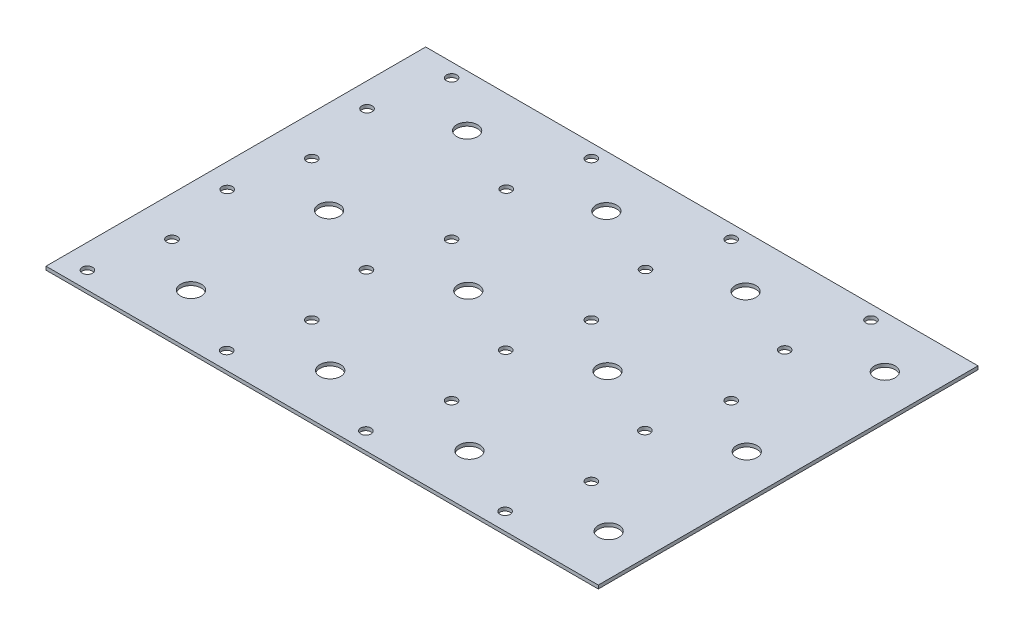
from build123d import *

# Parameters (mm, degrees)
SKETCH1_W           = 160
SKETCH1_H           = 110
BOSS_EXTRUDE1_DEPTH = 1
SKETCH2_R           = 3
SKETCH2_R_2         = 1.5
CUT_EXTRUDE1_DEPTH  = 1


with BuildPart() as part:
    # Sketch1 → Boss-Extrude1 (new body)
    with BuildSketch(Plane(origin=(0, 0, 0), x_dir=(1, 0, 0), z_dir=(0, 1, 0))):
        Rectangle(SKETCH1_W, SKETCH1_H)
    extrude(amount=BOSS_EXTRUDE1_DEPTH)

    # Sketch2 → Cut-Extrude1 (cut)
    with BuildSketch(Plane(origin=(0, 1, 0), x_dir=(1, 0, 0), z_dir=(0, 1, 0))):
        with Locations(Location((-53, 40, 0), (0, 0, 270))):
            Circle(SKETCH2_R)
        with Locations(Location((-12.666666667, 40, 0), (0, 0, 270))):
            Circle(SKETCH2_R)
        with Locations(Location((27.666666667, 40, 0), (0, 0, 270))):
            Circle(SKETCH2_R)
        with Locations(Location((68, 40, 0), (0, 0, 270))):
            Circle(SKETCH2_R)
        with Locations(Location((-12.666666667, 0, 0), (0, 0, 270))):
            Circle(SKETCH2_R)
        with Locations(Location((27.666666667, 0, 0), (0, 0, 270))):
            Circle(SKETCH2_R)
        with Locations(Location((68, 0, 0), (0, 0, 270))):
            Circle(SKETCH2_R)
        with Locations(Location((-12.666666667, -40, 0), (0, 0, 270))):
            Circle(SKETCH2_R)
        with Locations(Location((27.666666667, -40, 0), (0, 0, 270))):
            Circle(SKETCH2_R)
        with Locations(Location((68, -40, 0), (0, 0, 270))):
            Circle(SKETCH2_R)
        with Locations(Location((-53, 0, 0), (0, 0, 270))):
            Circle(SKETCH2_R)
        with Locations(Location((-53, -40, 0), (0, 0, 270))):
            Circle(SKETCH2_R)
        with Locations(Location((-68.5, 51, 0), (0, 0, 270))):
            Circle(SKETCH2_R_2)
        with Locations(Location((-28, 51, 0), (0, 0, 270))):
            Circle(SKETCH2_R_2)
        with Locations(Location((12.5, 51, 0), (0, 0, 270))):
            Circle(SKETCH2_R_2)
        with Locations(Location((53, 51, 0), (0, 0, 270))):
            Circle(SKETCH2_R_2)
        with Locations(Location((-28, 10.5, 0), (0, 0, 270))):
            Circle(SKETCH2_R_2)
        with Locations(Location((12.5, 10.5, 0), (0, 0, 270))):
            Circle(SKETCH2_R_2)
        with Locations(Location((53, 10.5, 0), (0, 0, 270))):
            Circle(SKETCH2_R_2)
        with Locations(Location((-28, -30, 0), (0, 0, 270))):
            Circle(SKETCH2_R_2)
        with Locations(Location((12.5, -30, 0), (0, 0, 270))):
            Circle(SKETCH2_R_2)
        with Locations(Location((53, -30, 0), (0, 0, 270))):
            Circle(SKETCH2_R_2)
        with Locations(Location((-68.5, 10.5, 0), (0, 0, 270))):
            Circle(SKETCH2_R_2)
        with Locations(Location((-68.5, -30, 0), (0, 0, 270))):
            Circle(SKETCH2_R_2)
        with Locations(Location((-73, 31, 0), (0, 0, 270))):
            Circle(SKETCH2_R_2)
        with Locations(Location((-32.666666667, 31, 0), (0, 0, 270))):
            Circle(SKETCH2_R_2)
        with Locations(Location((7.666666667, 31, 0), (0, 0, 270))):
            Circle(SKETCH2_R_2)
        with Locations(Location((48, 31, 0), (0, 0, 270))):
            Circle(SKETCH2_R_2)
        with Locations(Location((-32.666666667, -9.5, 0), (0, 0, 270))):
            Circle(SKETCH2_R_2)
        with Locations(Location((7.666666667, -9.5, 0), (0, 0, 270))):
            Circle(SKETCH2_R_2)
        with Locations(Location((48, -9.5, 0), (0, 0, 270))):
            Circle(SKETCH2_R_2)
        with Locations(Location((-32.666666667, -50, 0), (0, 0, 270))):
            Circle(SKETCH2_R_2)
        with Locations(Location((7.666666667, -50, 0), (0, 0, 270))):
            Circle(SKETCH2_R_2)
        with Locations(Location((48, -50, 0), (0, 0, 270))):
            Circle(SKETCH2_R_2)
        with Locations(Location((-73, -9.5, 0), (0, 0, 270))):
            Circle(SKETCH2_R_2)
        with Locations(Location((-73, -50, 0), (0, 0, 270))):
            Circle(SKETCH2_R_2)
    extrude(amount=-CUT_EXTRUDE1_DEPTH, mode=Mode.SUBTRACT)


solid = part.part
